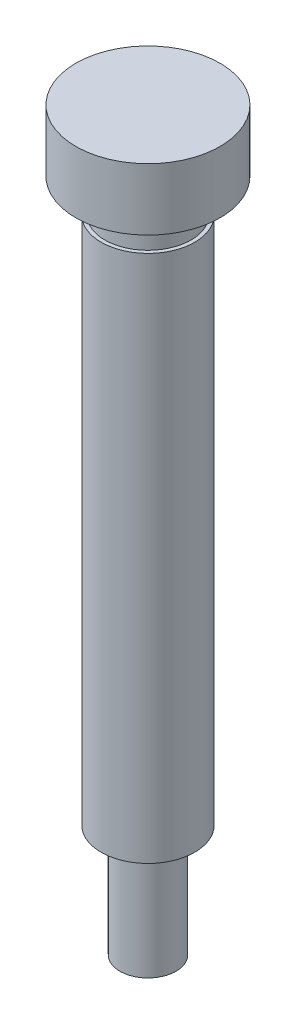
from build123d import *


with BuildPart() as part:
    # Sketch1 → Revolve1 (revolve)
    with BuildSketch(Plane.XY, mode=Mode.PRIVATE) as revolve1_sk:
        Polygon((0, 0), (1.5, 0), (1.5, 6), (2.5, 6), (2.5, 34.2), (2.3, 34.2), (2.3, 36), (3.85, 36), (3.85, 39.3), (0, 39.3), align=None)
    revolve(revolve1_sk.sketch.rotate(Axis((0, 39.3, 0), (0, -1, 0)), 180), axis=Axis((0, 39.3, 0), (0, -1, 0)))


solid = part.part
